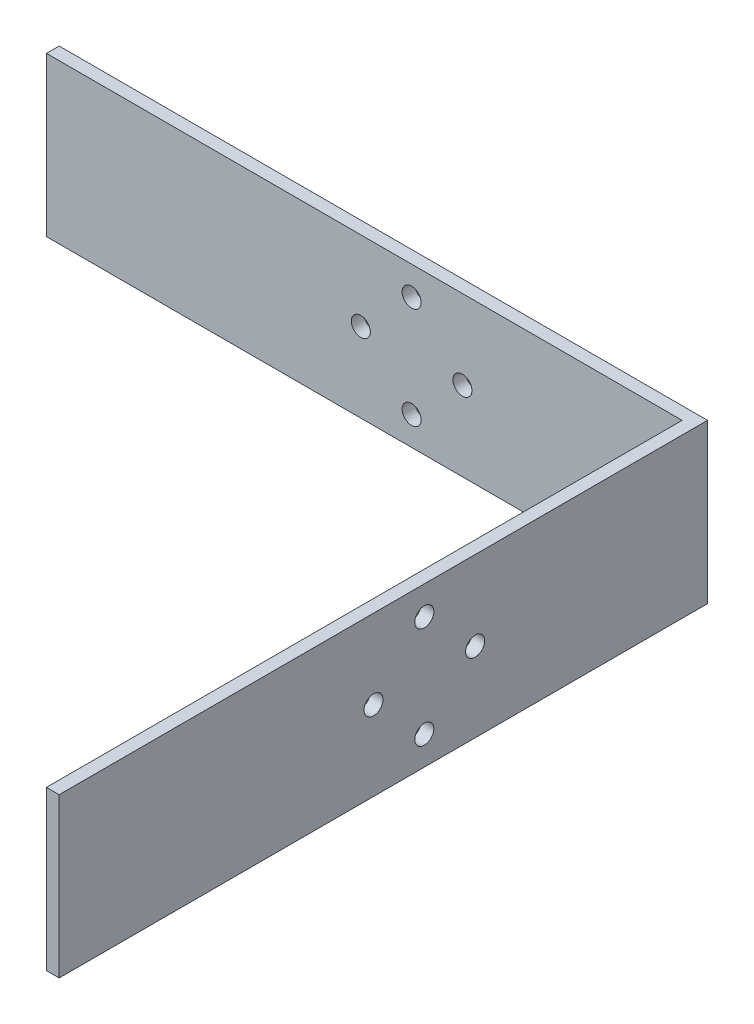
from build123d import *

# Parameters (mm, degrees)
BOSS_EXTRUDE1_DEPTH = 25
SKETCH2_R           = 1.5
CUT_EXTRUDE1_DEPTH  = 11.313708668
SKETCH3_R           = 1.5
CUT_EXTRUDE2_DEPTH  = 25


with BuildPart() as part:
    # Sketch1 → Boss-Extrude1 (new body)
    with BuildSketch(Plane(origin=(0, 0, 0), x_dir=(1, 0, 0), z_dir=(0, 1, 0))):
        Polygon((0, 0), (102.1, 0), (102.1, -102.1), (100.1, -102.1), (100.1, -2), (0, -2), align=None)
    extrude(amount=-BOSS_EXTRUDE1_DEPTH)

    # Sketch2 → Cut-Extrude1 (cut)
    with BuildSketch(Plane(origin=(0, 0, 0), x_dir=(-1, 0, 0), z_dir=(0, 0, -1))):
        with Locations((-65.500000119, -12.5)):
            Circle(SKETCH2_R)
        with Locations((-57.5, -20.500000119)):
            Circle(SKETCH2_R)
        with Locations((-49.499999881, -12.5)):
            Circle(SKETCH2_R)
        with Locations((-57.5, -4.499999881)):
            Circle(SKETCH2_R)
    extrude(amount=-CUT_EXTRUDE1_DEPTH, mode=Mode.SUBTRACT)

    # Sketch3 → Cut-Extrude2 (cut)
    with BuildSketch(Plane(origin=(102.1, 0, 0), x_dir=(0, 0, -1), z_dir=(1, 0, 0))):
        with Locations((-44.6, -4.499999881)):
            Circle(SKETCH3_R)
        with Locations((-36.599999881, -12.5)):
            Circle(SKETCH3_R)
        with Locations((-52.600000119, -12.5)):
            Circle(SKETCH3_R)
        with Locations((-44.6, -20.500000119)):
            Circle(SKETCH3_R)
    extrude(amount=-CUT_EXTRUDE2_DEPTH, mode=Mode.SUBTRACT)


solid = part.part
